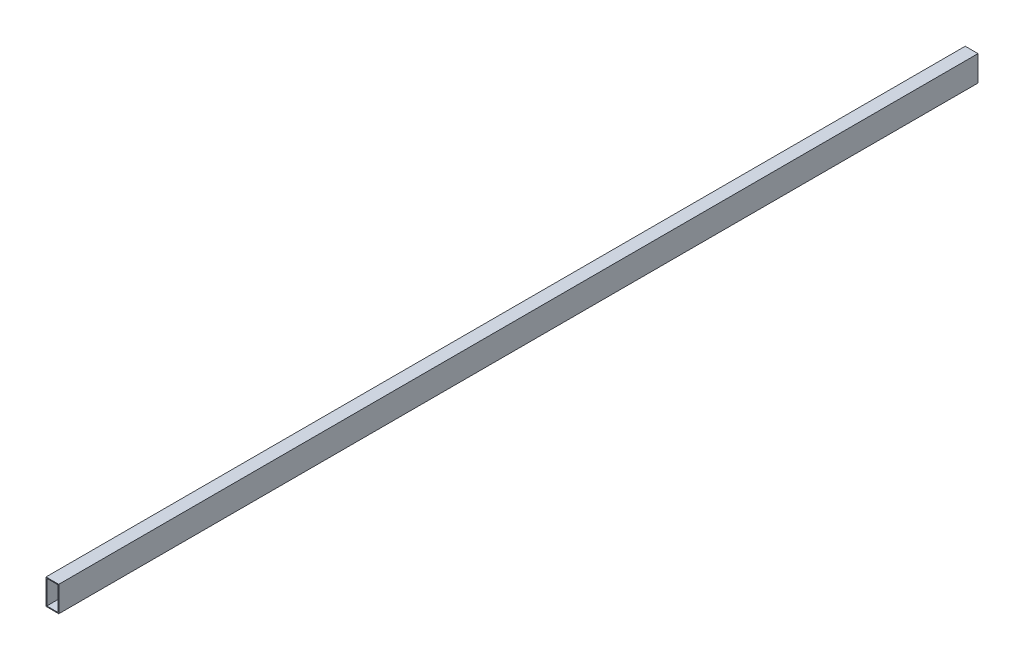
from build123d import *

# Parameters (mm, degrees)
SKETCH1_W           = 25.4
SKETCH1_H           = 50.8
SKETCH1_W_2         = 22.2504
SKETCH1_H_2         = 47.6504
BOSS_EXTRUDE1_DEPTH = 1828.8


with BuildPart() as part:
    # Sketch1 → Boss-Extrude1 (new body)
    with BuildSketch(Plane.XY):
        Rectangle(SKETCH1_W, SKETCH1_H)
        Rectangle(SKETCH1_W_2, SKETCH1_H_2, mode=Mode.SUBTRACT)
    extrude(amount=BOSS_EXTRUDE1_DEPTH)


solid = part.part
